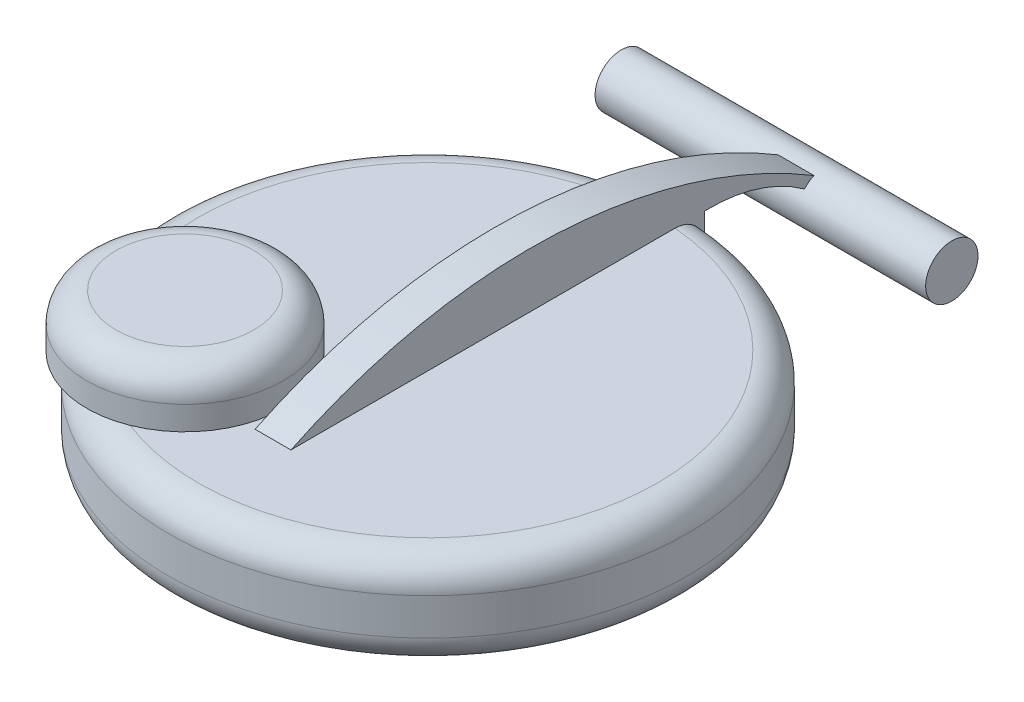
from build123d import *

# Parameters (mm, degrees)
SKETCH1_R           = 2.2606
BOSS_EXTRUDE1_DEPTH = 28.575
BOSS_EXTRUDE2_DEPTH = 3.0988
SKETCH3_R           = 22.4028
BOSS_EXTRUDE3_DEPTH = 8.255
FILLET1_R           = 2.54
SKETCH4_R           = 8.4963
BOSS_EXTRUDE4_DEPTH = 4.5974
FILLET2_R           = 2.54


with BuildPart() as part:
    # Sketch1 → Boss-Extrude1 (new body)
    with BuildSketch(Plane(origin=(0, 0, 0), x_dir=(0, 0, -1), z_dir=(1, 0, 0))):
        Circle(SKETCH1_R)
    extrude(amount=BOSS_EXTRUDE1_DEPTH)

    # Sketch2 → Boss-Extrude2 (add)
    with BuildSketch(Plane(origin=(17.5514, 0, 0), x_dir=(0, 0, -1), z_dir=(1, 0, 0))):
        with BuildLine():
            Line((-46.101, 4.1402), (-10.3124, 4.1402))
            ThreePointArc((-10.3124, 4.1402), (-4.725931778, 3.141811032), (0, 0))
            Line((0, 0), (2.2606, 0))
            ThreePointArc((2.2606, 0), (-21.350803051, 8.721215285), (-46.101, 4.1402))
        make_face()
    extrude(amount=-BOSS_EXTRUDE2_DEPTH)

    # Sketch3 → Boss-Extrude3 (add)
    with BuildSketch(Plane.XZ.offset(-4.1402)):
        with Locations(Location((16.002, 32.7152, 0), (0, 0, 270))):
            Circle(SKETCH3_R)
    extrude(amount=BOSS_EXTRUDE3_DEPTH)

    # Fillet1
    fillet1_edges = [part.edges().sort_by_distance(p)[0] for p in [
        (16.002, 4.1402, 55.118),
        (16.002, -4.1148, 55.118),
    ]]
    fillet(fillet1_edges, radius=FILLET1_R)

    # Sketch4 → Boss-Extrude4 (add)
    with BuildSketch(Plane(origin=(0, 4.1402, 0), x_dir=(1, 0, 0), z_dir=(0, 1, 0))):
        with Locations(Location((5.61488389, -43.318674516, 0), (0, 0, 159.448311982))):
            Circle(SKETCH4_R)
    extrude(amount=BOSS_EXTRUDE4_DEPTH)

    # Fillet2
    fillet2_edges = [part.edges().sort_by_distance(p)[0] for p in [
        (13.570444327, 8.7376, 46.301319621),
    ]]
    fillet(fillet2_edges, radius=FILLET2_R)


solid = part.part
